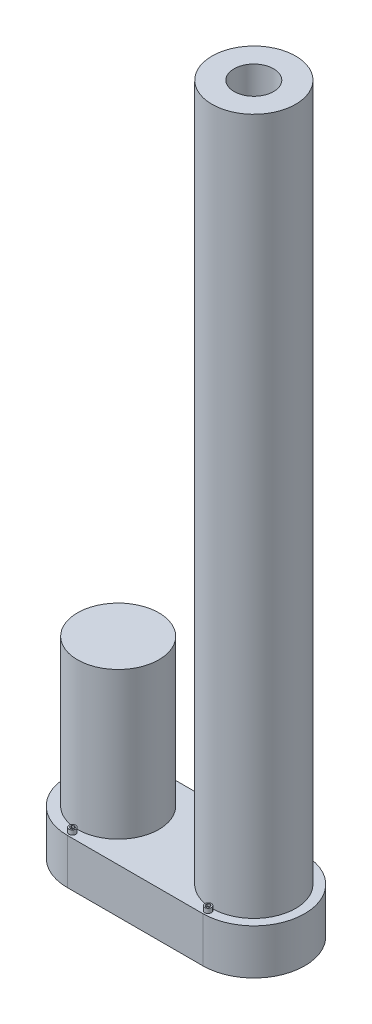
from build123d import *

# Parameters (mm, degrees)
BOSS_EXTRUDE1_DEPTH     = 20
SKETCH2_R               = 18
BOSS_EXTRUDE2_DEPTH     = 65
SKETCH3_R               = 18.5
BOSS_EXTRUDE3_DEPTH     = 308
SKETCH4_R               = 8.75
CUT_EXTRUDE1_DEPTH      = 203.2
SKETCH8_R               = 1
CUT_EXTRUDE2_DEPTH      = 20
SKETCH9_R               = 1.5
BOSS_EXTRUDE4_DEPTH     = 2
CUT_EXTRUDE3_DEPTH      = 1
SKETCH11_R              = 1
BOSS_EXTRUDE5_DEPTH     = 20
MIRROR2_COPY_1_SKETCH_R = 1
MIRROR2_COPY_1_DEPTH    = 20
MIRROR2_COPY_2_SKETCH_R = 1.5
MIRROR2_COPY_2_DEPTH    = 2
MIRROR2_COPY_3_DEPTH    = 1
MIRROR2_COPY_4_SKETCH_R = 1
MIRROR2_COPY_4_DEPTH    = 20
MIRROR2_COPY_5_SKETCH_R = 1
MIRROR2_COPY_5_DEPTH    = 20
MIRROR2_COPY_6_SKETCH_R = 1
MIRROR2_COPY_6_DEPTH    = 20


with BuildPart() as part:
    # Sketch1 → Boss-Extrude1 (new body)
    with BuildSketch(Plane(origin=(0, 0, 0), x_dir=(1, 0, 0), z_dir=(0, 1, 0))):
        with BuildLine():
            Line((30, 22.5), (-30, 22.5))
            ThreePointArc((-30, 22.5), (-52.5, 0), (-30, -22.5))
            Line((-30, -22.5), (30, -22.5))
            ThreePointArc((30, -22.5), (52.5, 0), (30, 22.5))
        make_face()
    extrude(amount=BOSS_EXTRUDE1_DEPTH)

    # Sketch2 → Boss-Extrude2 (add)
    with BuildSketch(Plane(origin=(0, 20, 0), x_dir=(1, 0, 0), z_dir=(0, 1, 0))):
        with Locations(Location((-30, 0, 0), (0, 0, 270))):
            Circle(SKETCH2_R)
    extrude(amount=BOSS_EXTRUDE2_DEPTH)

    # Sketch3 → Boss-Extrude3 (add)
    with BuildSketch(Plane(origin=(0, 20, 0), x_dir=(1, 0, 0), z_dir=(0, 1, 0))):
        with Locations(Location((30, 0, 0), (0, 0, 270))):
            Circle(SKETCH3_R)
    extrude(amount=BOSS_EXTRUDE3_DEPTH)

    # Sketch4 → Cut-Extrude1 (cut)
    with BuildSketch(Plane(origin=(0, 328, 0), x_dir=(1, 0, 0), z_dir=(0, 1, 0))):
        with Locations(Location((30, 0, 0), (0, 0, 270))):
            Circle(SKETCH4_R)
    extrude(amount=-CUT_EXTRUDE1_DEPTH, mode=Mode.SUBTRACT)

    # Sketch8 → Cut-Extrude2 (cut)
    with BuildSketch(Plane(origin=(0, 20, 0), x_dir=(1, 0, 0), z_dir=(0, 1, 0))):
        with Locations(Location((-30, -20.25, 0), (0, 0, 270))):
            Circle(SKETCH8_R)
    cut_extrude2 = extrude(amount=-CUT_EXTRUDE2_DEPTH, mode=Mode.SUBTRACT)

    # Sketch9 → Boss-Extrude4 (add)
    with BuildSketch(Plane(origin=(0, 20, 0), x_dir=(1, 0, 0), z_dir=(0, 1, 0))):
        with Locations(Location((-30, -20.25, 0), (0, 0, 270))):
            Circle(SKETCH9_R)
    boss_extrude4 = extrude(amount=BOSS_EXTRUDE4_DEPTH)

    # Sketch10 → Cut-Extrude3 (cut)
    with BuildSketch(Plane(origin=(0, 22, 0), x_dir=(1, 0, 0), z_dir=(0, 1, 0))):
        Polygon((-29.133974596, -20.75), (-29.133974596, -19.75), (-30, -19.25), (-30.866025404, -19.75), (-30.866025404, -20.75), (-30, -21.25), align=None)
    cut_extrude3 = extrude(amount=-CUT_EXTRUDE3_DEPTH, mode=Mode.SUBTRACT)

    # Sketch11 → Boss-Extrude5 (add)
    with BuildSketch(Plane.XZ.offset(-20)):
        with Locations((-30, 20.25)):
            Circle(SKETCH11_R)
    boss_extrude5 = extrude(amount=BOSS_EXTRUDE5_DEPTH)

    # Mirror1: Cut-Extrude2, Boss-Extrude4, Cut-Extrude3, Boss-Extrude5 across plane
    add(cut_extrude2.mirror(Plane(origin=(0, 0, 0), x_dir=(0, 0, 1), z_dir=(1, 0, 0))), mode=Mode.SUBTRACT)
    add(boss_extrude4.mirror(Plane(origin=(0, 0, 0), x_dir=(0, 0, 1), z_dir=(1, 0, 0))))
    add(cut_extrude3.mirror(Plane(origin=(0, 0, 0), x_dir=(0, 0, 1), z_dir=(1, 0, 0))), mode=Mode.SUBTRACT)
    add(boss_extrude5.mirror(Plane(origin=(0, 0, 0), x_dir=(0, 0, 1), z_dir=(1, 0, 0))))

    # Mirror2: Boss-Extrude4, Cut-Extrude3 across plane
    add(boss_extrude4.mirror(Plane.XY))
    add(cut_extrude3.mirror(Plane.XY), mode=Mode.SUBTRACT)

    # Mirror2 copy 1 sketch → Mirror2 copy 1 (cut)
    with BuildSketch(Plane(origin=(0, 20, 0), x_dir=(-1, 0, 0), z_dir=(0, 1, 0))):
        with Locations(Location((-30, -20.25, 0), (0, 0, 270))):
            Circle(MIRROR2_COPY_1_SKETCH_R)
    extrude(amount=-MIRROR2_COPY_1_DEPTH, mode=Mode.SUBTRACT)

    # Mirror2 copy 2 sketch → Mirror2 copy 2 (add)
    with BuildSketch(Plane(origin=(0, 20, 0), x_dir=(-1, 0, 0), z_dir=(0, 1, 0))):
        with Locations(Location((-30, -20.25, 0), (0, 0, 270))):
            Circle(MIRROR2_COPY_2_SKETCH_R)
    extrude(amount=MIRROR2_COPY_2_DEPTH)

    # Mirror2 copy 3 sketch → Mirror2 copy 3 (cut)
    with BuildSketch(Plane(origin=(0, 22, 0), x_dir=(-1, 0, 0), z_dir=(0, 1, 0))):
        Polygon((-29.133974596, -20.75), (-29.133974596, -19.75), (-30, -19.25), (-30.866025404, -19.75), (-30.866025404, -20.75), (-30, -21.25), align=None)
    extrude(amount=-MIRROR2_COPY_3_DEPTH, mode=Mode.SUBTRACT)

    # Mirror2 copy 4 sketch → Mirror2 copy 4 (add)
    with BuildSketch(Plane(origin=(0, 20, 0), x_dir=(-1, 0, 0), z_dir=(0, -1, 0))):
        with Locations((-30, 20.25)):
            Circle(MIRROR2_COPY_4_SKETCH_R)
    extrude(amount=MIRROR2_COPY_4_DEPTH)

    # Mirror2 copy 5 sketch → Mirror2 copy 5 (cut)
    with BuildSketch(Plane(origin=(0, 20, 0), x_dir=(1, 0, 0), z_dir=(0, 1, 0))):
        with Locations((-30, 20.25)):
            Circle(MIRROR2_COPY_5_SKETCH_R)
    extrude(amount=-MIRROR2_COPY_5_DEPTH, mode=Mode.SUBTRACT)

    # Mirror2 copy 6 sketch → Mirror2 copy 6 (add)
    with BuildSketch(Plane.XZ.offset(-20)):
        with Locations((-30, -20.25)):
            Circle(MIRROR2_COPY_6_SKETCH_R)
    extrude(amount=MIRROR2_COPY_6_DEPTH)


solid = part.part
